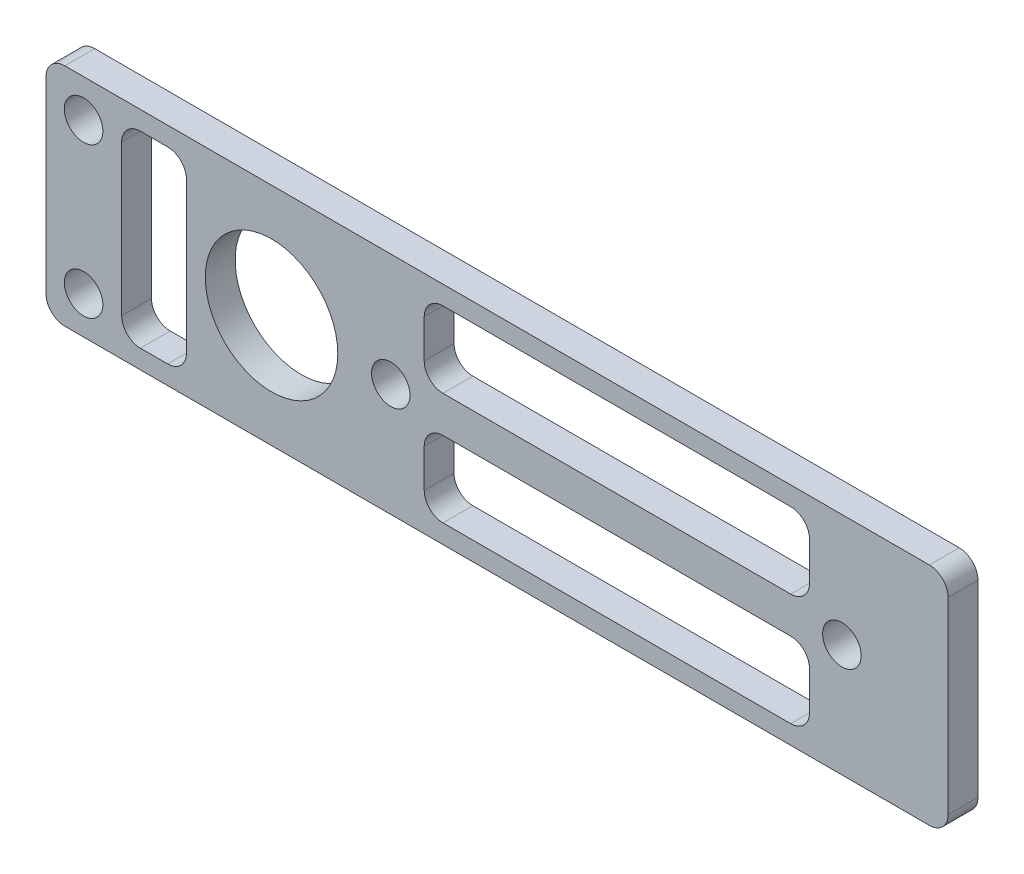
from build123d import *

# Parameters (mm, degrees)
SKETCH1_W           = 96
SKETCH1_H           = 24
SKETCH1_R           = 7.05
SKETCH1_R_2         = 2.05
SKETCH1_W_2         = 41
SKETCH1_H_2         = 8.061482978
SKETCH1_W_3         = 6.9
SKETCH1_H_3         = 20
BOSS_EXTRUDE1_DEPTH = 3.175
FILLET1_R           = 2


with BuildPart() as part:
    # Sketch1 → Boss-Extrude1 (new body)
    with BuildSketch(Plane.XY):
        Rectangle(SKETCH1_W, SKETCH1_H)
        with Locations((-24, 0)):
            Circle(SKETCH1_R, mode=Mode.SUBTRACT)
        with Locations((-11.31, 0)):
            Circle(SKETCH1_R_2, mode=Mode.SUBTRACT)
        with Locations((36.69, 0)):
            Circle(SKETCH1_R_2, mode=Mode.SUBTRACT)
        with Locations((-44, 8)):
            Circle(SKETCH1_R_2, mode=Mode.SUBTRACT)
        with Locations(Location((-44, -8, 0), (0, 0, 180))):
            Circle(SKETCH1_R_2, mode=Mode.SUBTRACT)
        with Locations((12.745931911, -5.969258511)):
            Rectangle(SKETCH1_W_2, SKETCH1_H_2, mode=Mode.SUBTRACT)
        with Locations((12.745931911, 5.969258511)):
            Rectangle(SKETCH1_W_2, SKETCH1_H_2, mode=Mode.SUBTRACT)
        with Locations((-36.5, 0)):
            Rectangle(SKETCH1_W_3, SKETCH1_H_3, mode=Mode.SUBTRACT)
    extrude(amount=BOSS_EXTRUDE1_DEPTH)

    # Fillet1
    fillet1_edges = [part.edges().sort_by_distance(p)[0] for p in [
        (-7.754068089, 10, 1.5875),
        (-7.754068089, 1.938517022, 1.5875),
        (33.245931911, 1.938517022, 1.5875),
        (33.245931911, 10, 1.5875),
        (-7.754068089, -1.938517022, 1.5875),
        (-7.754068089, -10, 1.5875),
        (33.245931911, -10, 1.5875),
        (33.245931911, -1.938517022, 1.5875),
        (-39.95, 10, 1.5875),
        (-39.95, -10, 1.5875),
        (-33.05, -10, 1.5875),
        (-33.05, 10, 1.5875),
        (-48, 12, 1.5875),
        (48, 12, 1.5875),
        (48, -12, 1.5875),
        (-48, -12, 1.5875),
    ]]
    fillet(fillet1_edges, radius=FILLET1_R)


solid = part.part
